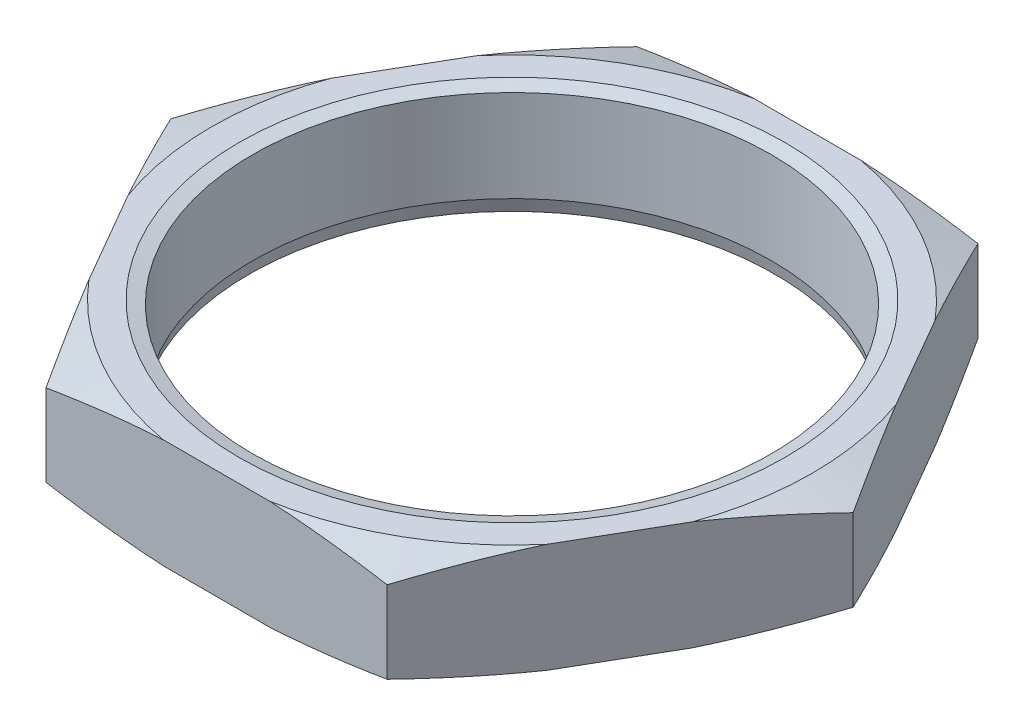
from build123d import *
from OCP.BRepFilletAPI import BRepFilletAPI_MakeChamfer

# Parameters (mm, degrees)
SKETCH_1_R      = 9.5
EXTRUDE_1_DEPTH = 4
CHAMFER_1_SIZE  = 0.5
CHAMFER_1_SIZE2 = 0.133974596


with BuildPart() as part:
    # 草图1 → 凸台-拉伸1 (new body)
    with BuildSketch(Plane(origin=(0, 0, 0), x_dir=(1, 0, 0), z_dir=(0, 1, 0))):
        Polygon((6.25, 10.825317547), (-6.25, 10.825317547), (-12.5, 0), (-6.25, -10.825317547), (6.25, -10.825317547), (12.5, 0), align=None)
        with Locations(Location((0, 0, 0), (0, 0, 270))):
            Circle(SKETCH_1_R, mode=Mode.SUBTRACT)
    extrude(amount=EXTRUDE_1_DEPTH)

    # 草图2 → 切除-旋转2 (revolve, cut)
    with BuildSketch(Plane.XY):
        Polygon((11, 4), (12.5, 4), (12.5, 3.5), align=None)
        Polygon((12.5, 0.5), (12.5, 0), (11, 0), align=None)
    revolve(axis=Axis((0, 0, 0), (0, 1, 0)), mode=Mode.SUBTRACT)

    # 倒角1: one chamfer whose edges measure the first distance from different faces: ONE call of the kernel's chamfer builder (chamfer() names one face for all edges)
    chamfer_1_edges_1 = [part.edges().sort_by_distance(p)[0] for p in [
        (0, 0, -9.5),
    ]]
    chamfer_1_side_1 = [part.faces().sort_by_distance(p)[0] for p in [
        (0, 2, -9.5),
    ]]
    chamfer_1_edges_2 = [part.edges().sort_by_distance(p)[0] for p in [
        (0, 4, -9.5),
    ]]
    chamfer_1_side_2 = [part.faces().sort_by_distance(p)[0] for p in [
        (5.345666757, 4, -9.258966423),
    ]]
    chamfer_1 = BRepFilletAPI_MakeChamfer(part.part.solid().wrapped)
    for e in chamfer_1_edges_1:
        chamfer_1.Add(CHAMFER_1_SIZE, CHAMFER_1_SIZE2, e.wrapped, chamfer_1_side_1[0].wrapped)  # the first distance lies on this face
    for e in chamfer_1_edges_2:
        chamfer_1.Add(CHAMFER_1_SIZE, CHAMFER_1_SIZE2, e.wrapped, chamfer_1_side_2[0].wrapped)  # the first distance lies on this face
    add(Compound.cast(chamfer_1.Shape()), mode=Mode.REPLACE)


solid = part.part
